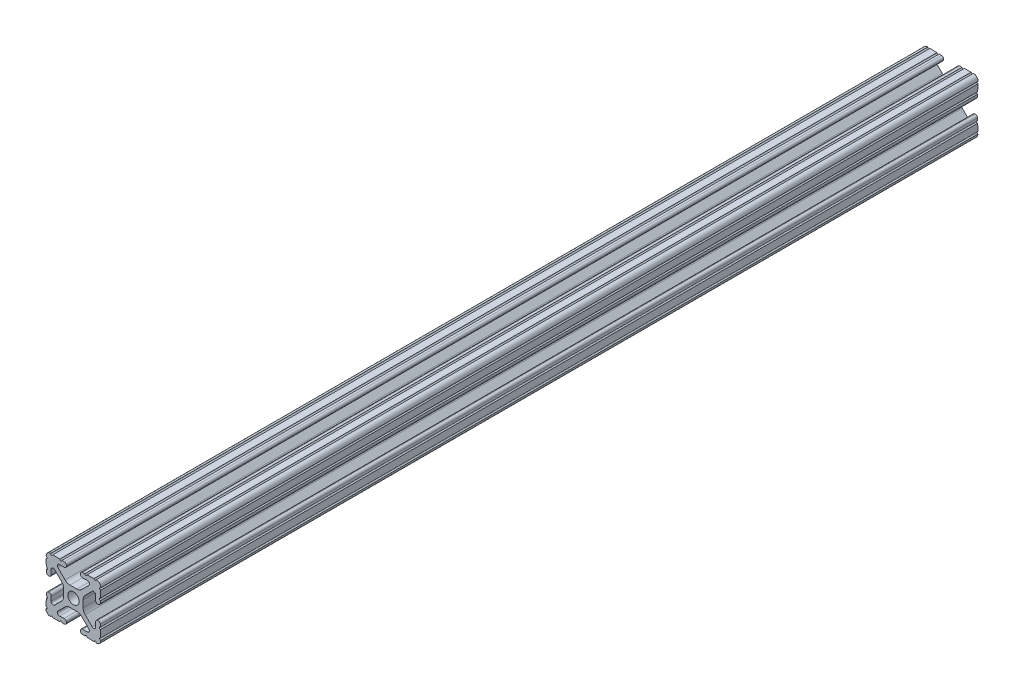
from build123d import *

# Parameters (mm, degrees)
BOSS_EXTRUDE1_DEPTH = 203.2
SKETCH4_R           = 0.508
CUT_EXTRUDE1_DEPTH  = 204.992205733
CIRPATTERN1_COUNT   = 4


with BuildPart() as part:
    # Sketch3 → Boss-Extrude1 (new, symmetric)
    with BuildSketch(Plane.XY):
        with BuildLine():
            Line((-4.4958, 0), (-2.6035, 0))
            ThreePointArc((-2.6035, 0), (-2.405320363, 0.996316316), (-1.840952505, 1.840952505))
            ThreePointArc((-1.840952505, 1.840952505), (-0.996316316, 2.405320363), (0, 2.6035))
            Line((0, 2.6035), (0, 4.4958))
            Line((0, 4.4958), (-1.618107374, 4.4958))
            ThreePointArc((-1.618107374, 4.4958), (-2.833127272, 4.737482484), (-3.863171405, 5.42573597))
            Line((-3.863171405, 5.42573597), (-7.134523758, 8.697088323))
            ThreePointArc((-7.134523758, 8.697088323), (-7.336866533, 9.762858418), (-6.419414188, 10.341727737))
            Line((-6.419414188, 10.341727737), (-4.333376572, 10.268881698))
            ThreePointArc((-4.333376572, 10.268881698), (-3.586799144, 10.548015561), (-3.256266629, 11.27330297))
            Line((-3.256266629, 11.27330297), (-3.251834393, 11.400225605))
            ThreePointArc((-3.251834393, 11.400225605), (-3.530968255, 12.146803033), (-4.256255664, 12.477335548))
            Line((-4.256255664, 12.477335548), (-10.597084223, 12.698762161))
            ThreePointArc((-10.597084223, 12.698762161), (-12.104840979, 12.104840979), (-12.698762161, 10.597084223))
            Line((-12.698762161, 10.597084223), (-12.477335548, 4.256255664))
            ThreePointArc((-12.477335548, 4.256255664), (-12.146803033, 3.530968255), (-11.400225605, 3.251834393))
            Line((-11.400225605, 3.251834393), (-11.27330297, 3.256266629))
            ThreePointArc((-11.27330297, 3.256266629), (-10.548015561, 3.586799144), (-10.268881698, 4.333376572))
            Line((-10.268881698, 4.333376572), (-10.341727737, 6.419414188))
            ThreePointArc((-10.341727737, 6.419414188), (-9.762858418, 7.336866533), (-8.697088323, 7.134523758))
            Line((-8.697088323, 7.134523758), (-5.42573597, 3.863171405))
            ThreePointArc((-5.42573597, 3.863171405), (-4.737482484, 2.833127272), (-4.4958, 1.618107374))
            Line((-4.4958, 1.618107374), (-4.4958, 0))
        make_face()
    boss_extrude1 = extrude(amount=BOSS_EXTRUDE1_DEPTH, both=True)

    # Sketch4 → Cut-Extrude1 (cut, symmetric)
    with BuildSketch(Plane.XY):
        with Locations((-5.819260055, 12.531916864)):
            Circle(SKETCH4_R)
        with Locations((-10.058476065, 12.679953549)):
            Circle(SKETCH4_R)
        with Locations((-12.679953549, 10.058476065)):
            Circle(SKETCH4_R)
        with Locations((-12.531916864, 5.819260055)):
            Circle(SKETCH4_R)
    cut_extrude1 = extrude(amount=CUT_EXTRUDE1_DEPTH, both=True, mode=Mode.SUBTRACT)

    # CirPattern1: Boss-Extrude1, Cut-Extrude1 ×4 about axis
    cirpattern1_axis = Axis((0, 0, 0), (0, 0, 1))
    add([boss_extrude1.rotate(cirpattern1_axis, i * 360 / CIRPATTERN1_COUNT) for i in range(1, CIRPATTERN1_COUNT)])
    add([cut_extrude1.rotate(cirpattern1_axis, i * 360 / CIRPATTERN1_COUNT) for i in range(1, CIRPATTERN1_COUNT)], mode=Mode.SUBTRACT)


solid = part.part
